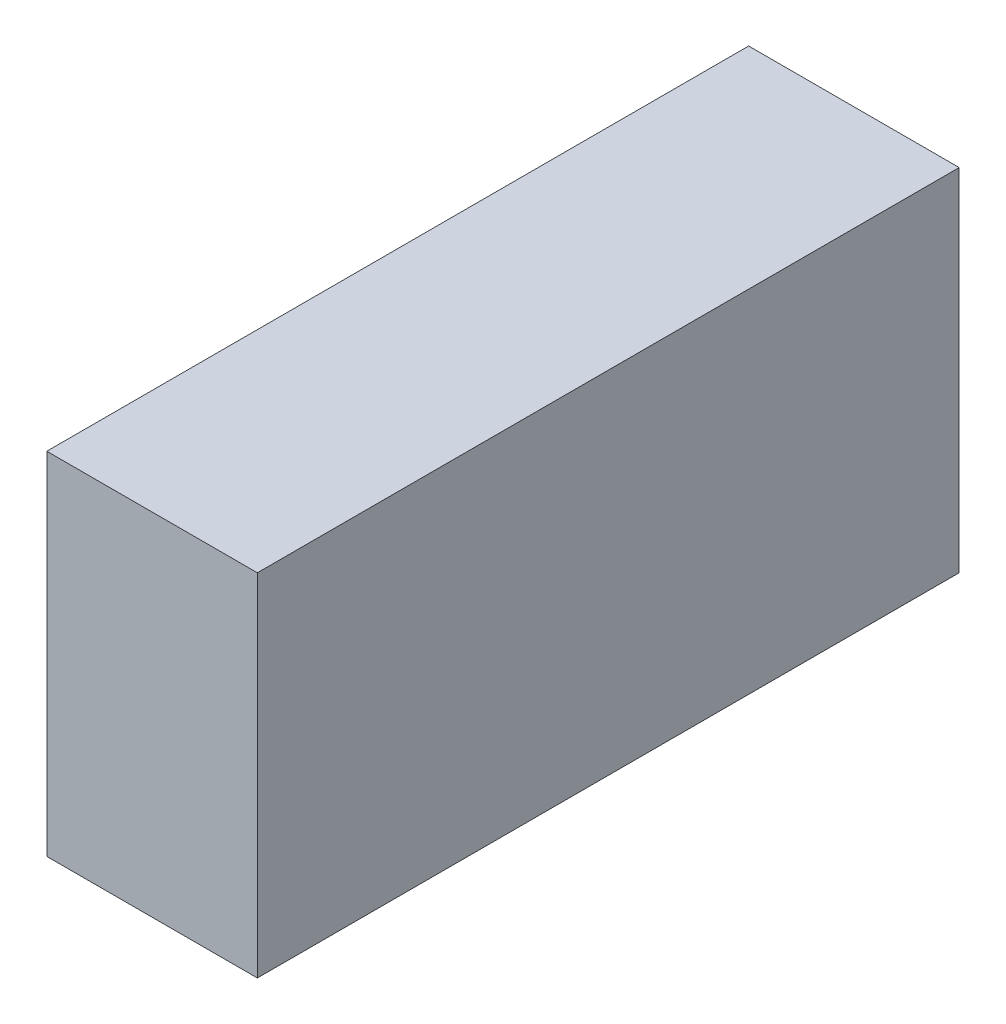
from build123d import *

# Parameters (mm, degrees)
CROQUIS1_W              = 120
CROQUIS1_H              = 200
SALIENTE_EXTRUIR1_DEPTH = 400


with BuildPart() as part:
    # Croquis1 → Saliente-Extruir1 (new body)
    with BuildSketch(Plane.XY):
        Rectangle(CROQUIS1_W, CROQUIS1_H)
    extrude(amount=SALIENTE_EXTRUIR1_DEPTH)


solid = part.part
